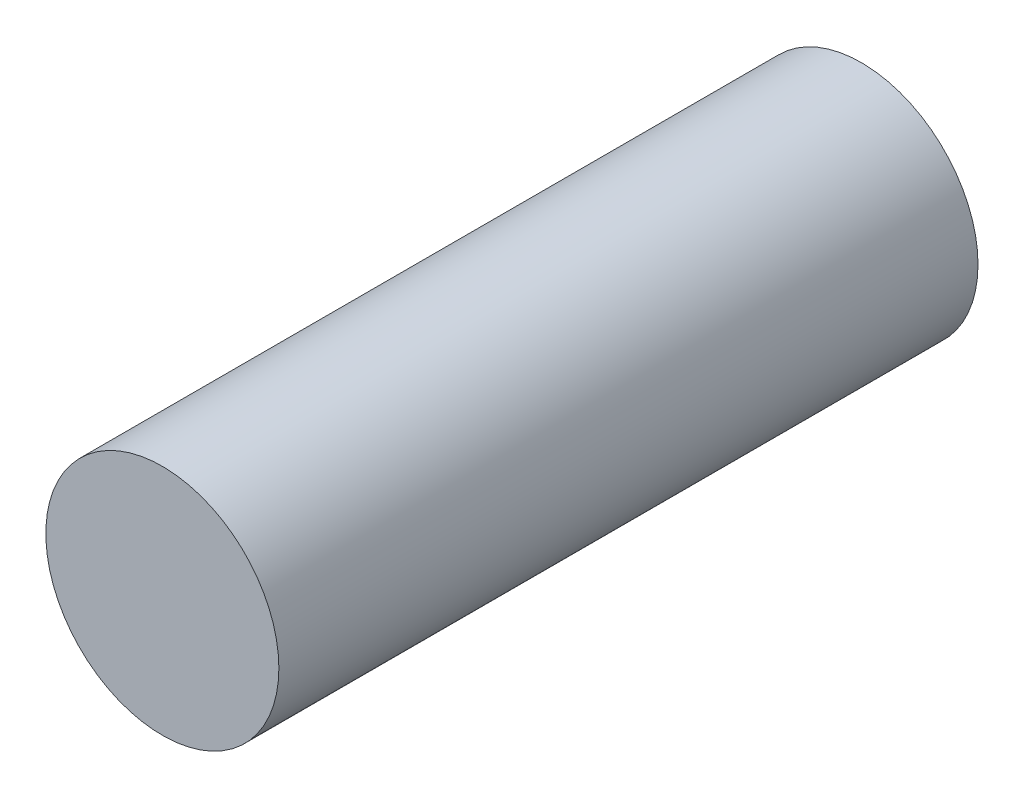
from build123d import *

# Parameters (mm, degrees)
SKETCH_1_R      = 5
EXTRUDE_1_DEPTH = 15


with BuildPart() as part:
    # 草图1 → 凸台-拉伸1 (new, symmetric)
    with BuildSketch(Plane.XY):
        Circle(SKETCH_1_R)
    extrude(amount=EXTRUDE_1_DEPTH, both=True)


solid = part.part
